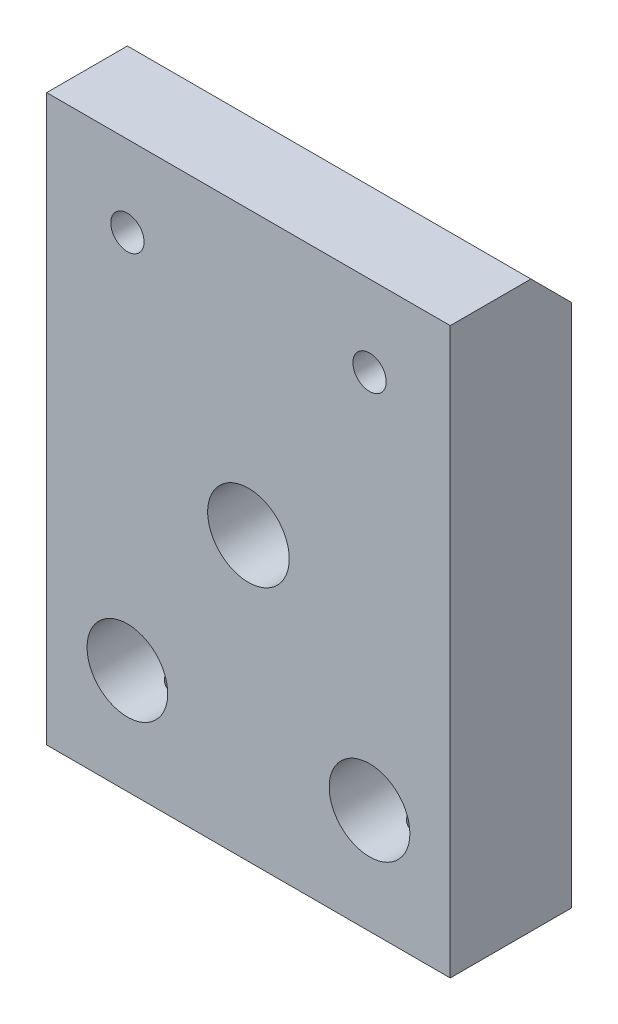
from build123d import *

# Parameters (mm, degrees)
ESQUISSE1_W             = 50
ESQUISSE1_H             = 70
ESQUISSE1_R             = 5
ESQUISSE1_R_2           = 5.055
ESQUISSE1_R_3           = 2.065
BASE_EXTRUSION_DEPTH    = 15
CHANFREIN3_SIZE         = 5
ENL_V_MAT_EXTRU_1_REACH = 77.829
ESQUISSE2_R             = 2.065


with BuildPart() as part:
    # Esquisse1 → Base-Extrusion (new body)
    with BuildSketch(Plane.XY):
        with Locations((0, 35)):
            Rectangle(ESQUISSE1_W, ESQUISSE1_H)
        with Locations((15, 13)):
            Circle(ESQUISSE1_R, mode=Mode.SUBTRACT)
        with Locations(Location((-15, 13, 0), (0, 0, 180))):
            Circle(ESQUISSE1_R, mode=Mode.SUBTRACT)
        with Locations((0, 35)):
            Circle(ESQUISSE1_R_2, mode=Mode.SUBTRACT)
        with Locations((-15, 60)):
            Circle(ESQUISSE1_R_3, mode=Mode.SUBTRACT)
        with Locations(Location((15, 60, 0), (0, 0, 180))):
            Circle(ESQUISSE1_R_3, mode=Mode.SUBTRACT)
    extrude(amount=BASE_EXTRUSION_DEPTH)

    # Chanfrein3
    chanfrein3_edges = [part.edges().sort_by_distance(p)[0] for p in [
        (0, 70, 0),
    ]]
    chamfer(chanfrein3_edges, length=CHANFREIN3_SIZE)

    # Esquisse2 → Enlèv. mat.-Extru.1 (cut, up to next)
    with BuildSketch(Plane.XZ, mode=Mode.PRIVATE) as enl_v_mat_extru_1_sk1:
        with Locations(Location((15, 7.5, 0), (0, 0, 270))):
            Circle(ESQUISSE2_R)
    enl_v_mat_extru_1_tool1 = extrude(enl_v_mat_extru_1_sk1.sketch, amount=-ENL_V_MAT_EXTRU_1_REACH, mode=Mode.PRIVATE) & part.part
    # Esquisse2 → Enlèv. mat.-Extru.1 (cut, up to next)
    with BuildSketch(Plane.XZ, mode=Mode.PRIVATE) as enl_v_mat_extru_1_sk2:
        with Locations(Location((-15, 7.5, 0), (0, 0, 270))):
            Circle(ESQUISSE2_R)
    enl_v_mat_extru_1_tool2 = extrude(enl_v_mat_extru_1_sk2.sketch, amount=-ENL_V_MAT_EXTRU_1_REACH, mode=Mode.PRIVATE) & part.part
    add(enl_v_mat_extru_1_tool1.solids().sort_by_distance((15, 0, 7.5))[0], mode=Mode.SUBTRACT)
    add(enl_v_mat_extru_1_tool2.solids().sort_by_distance((-15, 0, 7.5))[0], mode=Mode.SUBTRACT)


solid = part.part
